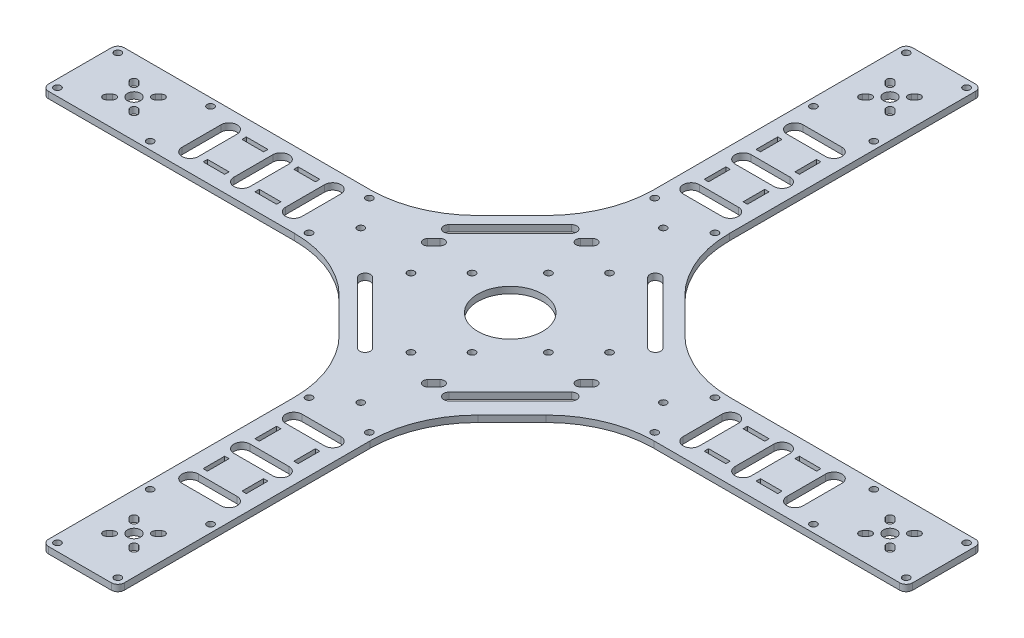
from build123d import *

# Parameters (mm, degrees)
SKETCH_203_R        = 1.6
SKETCH_203_W        = 10
SKETCH_203_H        = 2
SKETCH_203_R_2      = 3
SKETCH_203_W_2      = 2
SKETCH_203_H_2      = 10
EXTRUDE_1_DEPTH     = 3
FILLET_3_R          = 3
SKETCH_1_R          = 1.6
SKETCH_1_R_2        = 15
CUT_EXTRUDE_1_DEPTH = 10


with BuildPart() as part:
    # Sketch 203 → 凸台-拉伸1 (new body)
    with BuildSketch(Plane(origin=(0, 0, 0), x_dir=(1, 0, 0), z_dir=(0, 1, 0))):
        with BuildLine():
            Line((17.5, 25), (-17.5, 25))
            Line((-17.5, 25), (-17.5, -91.789321881))
            ThreePointArc((-17.5, -91.789321881), (-21.306023374, -110.9234935), (-32.144660941, -127.144660941))
            Line((-32.144660941, -127.144660941), (-47.855339059, -142.855339059))
            ThreePointArc((-47.855339059, -142.855339059), (-64.0765065, -153.693976626), (-83.210678119, -157.5))
            Line((-83.210678119, -157.5), (-200, -157.5))
            Line((-200, -157.5), (-200, -192.5))
            Line((-200, -192.5), (-83.210678119, -192.5))
            ThreePointArc((-83.210678119, -192.5), (-64.0765065, -196.306023374), (-47.855339059, -207.144660941))
            Line((-47.855339059, -207.144660941), (-32.144660941, -222.855339059))
            ThreePointArc((-32.144660941, -222.855339059), (-21.306023374, -239.0765065), (-17.5, -258.210678119))
            Line((-17.5, -258.210678119), (-17.5, -375))
            Line((-17.5, -375), (17.5, -375))
            Line((17.5, -375), (17.5, -258.210678119))
            ThreePointArc((17.5, -258.210678119), (21.306023374, -239.0765065), (32.144660941, -222.855339059))
            Line((32.144660941, -222.855339059), (47.855339059, -207.144660941))
            ThreePointArc((47.855339059, -207.144660941), (64.0765065, -196.306023374), (83.210678119, -192.5))
            Line((83.210678119, -192.5), (200, -192.5))
            Line((200, -192.5), (200, -157.5))
            Line((200, -157.5), (83.210678119, -157.5))
            ThreePointArc((83.210678119, -157.5), (64.0765065, -153.693976626), (47.855339059, -142.855339059))
            Line((47.855339059, -142.855339059), (32.144660941, -127.144660941))
            ThreePointArc((32.144660941, -127.144660941), (21.306023374, -110.9234935), (17.5, -91.789321881))
            Line((17.5, -91.789321881), (17.5, 25))
        make_face()
        with Locations(Location((-196.464466094, -188.964466094, 0), (0, 0, 270))):
            Circle(SKETCH_203_R, mode=Mode.SUBTRACT)
        with BuildLine():
            ThreePointArc((-181.081118318, -178.818376618), (-178.818376618, -178.818376618), (-178.818376618, -181.081118318))
            Line((-178.818376618, -181.081118318), (-180.232590181, -182.495331881))
            ThreePointArc((-180.232590181, -182.495331881), (-182.495331881, -182.495331881), (-182.495331881, -180.232590181))
            Line((-182.495331881, -180.232590181), (-181.081118318, -178.818376618))
        make_face(mode=Mode.SUBTRACT)
        with Locations(Location((-153.535533906, -188.964466094, 0), (0, 0, 270))):
            Circle(SKETCH_203_R, mode=Mode.SUBTRACT)
        with BuildLine():
            ThreePointArc((-171.181623382, -181.081118318), (-171.181623382, -178.818376618), (-168.918881682, -178.818376618))
            Line((-168.918881682, -178.818376618), (-167.504668119, -180.232590181))
            ThreePointArc((-167.504668119, -180.232590181), (-167.504668119, -182.495331881), (-169.767409819, -182.495331881))
            Line((-169.767409819, -182.495331881), (-171.181623382, -181.081118318))
        make_face(mode=Mode.SUBTRACT)
        with Locations((-128, -184)):
            Rectangle(SKETCH_203_W, SKETCH_203_H, mode=Mode.SUBTRACT)
        with Locations((-104, -184)):
            Rectangle(SKETCH_203_W, SKETCH_203_H, mode=Mode.SUBTRACT)
        with Locations(Location((-80, -188.964466094, 0), (0, 0, 270))):
            Circle(SKETCH_203_R, mode=Mode.SUBTRACT)
        with Locations(Location((-175, -175, 0), (0, 0, 270))):
            Circle(SKETCH_203_R_2, mode=Mode.SUBTRACT)
        with BuildLine():
            ThreePointArc((-178.818376618, -168.918881682), (-178.818376618, -171.181623382), (-181.081118318, -171.181623382))
            Line((-181.081118318, -171.181623382), (-182.495331881, -169.767409819))
            ThreePointArc((-182.495331881, -169.767409819), (-182.495331881, -167.504668119), (-180.232590181, -167.504668119))
            Line((-180.232590181, -167.504668119), (-178.818376618, -168.918881682))
        make_face(mode=Mode.SUBTRACT)
        with BuildLine():
            ThreePointArc((-168.918881682, -171.181623382), (-171.181623382, -171.181623382), (-171.181623382, -168.918881682))
            Line((-171.181623382, -168.918881682), (-169.767409819, -167.504668119))
            ThreePointArc((-169.767409819, -167.504668119), (-167.504668119, -167.504668119), (-167.504668119, -169.767409819))
            Line((-167.504668119, -169.767409819), (-168.918881682, -171.181623382))
        make_face(mode=Mode.SUBTRACT)
        with Locations(Location((-196.464466094, -161.035533906, 0), (0, 0, 270))):
            Circle(SKETCH_203_R, mode=Mode.SUBTRACT)
        with Locations(Location((-153.535533906, -161.035533906, 0), (0, 0, 270))):
            Circle(SKETCH_203_R, mode=Mode.SUBTRACT)
        with BuildLine():
            ThreePointArc((-143.75, -166), (-140, -162.25), (-136.25, -166))
            Line((-136.25, -166), (-136.25, -184))
            ThreePointArc((-136.25, -184), (-140, -187.75), (-143.75, -184))
            Line((-143.75, -184), (-143.75, -175))
            Line((-143.75, -175), (-143.75, -166))
        make_face(mode=Mode.SUBTRACT)
        Polygon((-133, -167), (-133, -166), (-133, -165), (-123, -165), (-123, -166), (-123, -167), align=None, mode=Mode.SUBTRACT)
        with BuildLine():
            Line((-119.75, -184), (-119.75, -166))
            ThreePointArc((-119.75, -166), (-116, -162.25), (-112.25, -166))
            Line((-112.25, -166), (-112.25, -184))
            ThreePointArc((-112.25, -184), (-116, -187.75), (-119.75, -184))
        make_face(mode=Mode.SUBTRACT)
        with Locations((-104, -166)):
            Rectangle(SKETCH_203_W, SKETCH_203_H, mode=Mode.SUBTRACT)
        with BuildLine():
            ThreePointArc((-88.25, -184), (-92, -187.75), (-95.75, -184))
            Line((-95.75, -184), (-95.75, -166))
            ThreePointArc((-95.75, -166), (-92, -162.25), (-88.25, -166))
            Line((-88.25, -166), (-88.25, -184))
        make_face(mode=Mode.SUBTRACT)
        with Locations(Location((-70, -175, 0), (0, 0, 270))):
            Circle(SKETCH_203_R, mode=Mode.SUBTRACT)
        with Locations(Location((-80, -161.035533906, 0), (0, 0, 270))):
            Circle(SKETCH_203_R, mode=Mode.SUBTRACT)
        with Locations(Location((0, -245, 0), (0, 0, 270))):
            Circle(SKETCH_203_R, mode=Mode.SUBTRACT)
        with Locations(Location((80, -188.964466094, 0), (0, 0, 270))):
            Circle(SKETCH_203_R, mode=Mode.SUBTRACT)
        with Locations((104, -184)):
            Rectangle(SKETCH_203_W, SKETCH_203_H, mode=Mode.SUBTRACT)
        Polygon((123, -183), (133, -183), (133, -184), (133, -185), (123, -185), (123, -184), align=None, mode=Mode.SUBTRACT)
        with Locations(Location((153.535533906, -188.964466094, 0), (0, 0, 270))):
            Circle(SKETCH_203_R, mode=Mode.SUBTRACT)
        with BuildLine():
            ThreePointArc((168.918881682, -178.818376618), (171.181623382, -178.818376618), (171.181623382, -181.081118318))
            Line((171.181623382, -181.081118318), (169.767409819, -182.495331881))
            ThreePointArc((169.767409819, -182.495331881), (167.504668119, -182.495331881), (167.504668119, -180.232590181))
            Line((167.504668119, -180.232590181), (168.918881682, -178.818376618))
        make_face(mode=Mode.SUBTRACT)
        with Locations(Location((196.464466094, -188.964466094, 0), (0, 0, 270))):
            Circle(SKETCH_203_R, mode=Mode.SUBTRACT)
        with BuildLine():
            ThreePointArc((178.818376618, -181.081118318), (178.818376618, -178.818376618), (181.081118318, -178.818376618))
            Line((181.081118318, -178.818376618), (182.495331881, -180.232590181))
            ThreePointArc((182.495331881, -180.232590181), (182.495331881, -182.495331881), (180.232590181, -182.495331881))
            Line((180.232590181, -182.495331881), (178.818376618, -181.081118318))
        make_face(mode=Mode.SUBTRACT)
        with Locations(Location((70, -175, 0), (0, 0, 270))):
            Circle(SKETCH_203_R, mode=Mode.SUBTRACT)
        with BuildLine():
            ThreePointArc((88.25, -166), (92, -162.25), (95.75, -166))
            Line((95.75, -166), (95.75, -184))
            ThreePointArc((95.75, -184), (92, -187.75), (88.25, -184))
            Line((88.25, -184), (88.25, -166))
        make_face(mode=Mode.SUBTRACT)
        with Locations(Location((80, -161.035533906, 0), (0, 0, 270))):
            Circle(SKETCH_203_R, mode=Mode.SUBTRACT)
        with BuildLine():
            Line((119.75, -166), (119.75, -184))
            ThreePointArc((119.75, -184), (116, -187.75), (112.25, -184))
            Line((112.25, -184), (112.25, -166))
            ThreePointArc((112.25, -166), (116, -162.25), (119.75, -166))
        make_face(mode=Mode.SUBTRACT)
        with Locations((104, -166)):
            Rectangle(SKETCH_203_W, SKETCH_203_H, mode=Mode.SUBTRACT)
        with BuildLine():
            ThreePointArc((143.75, -184), (140, -187.75), (136.25, -184))
            Line((136.25, -184), (136.25, -166))
            ThreePointArc((136.25, -166), (140, -162.25), (143.75, -166))
            Line((143.75, -166), (143.75, -175))
            Line((143.75, -175), (143.75, -184))
        make_face(mode=Mode.SUBTRACT)
        with Locations((128, -166)):
            Rectangle(SKETCH_203_W, SKETCH_203_H, mode=Mode.SUBTRACT)
        with BuildLine():
            ThreePointArc((171.181623382, -168.918881682), (171.181623382, -171.181623382), (168.918881682, -171.181623382))
            Line((168.918881682, -171.181623382), (167.504668119, -169.767409819))
            ThreePointArc((167.504668119, -169.767409819), (167.504668119, -167.504668119), (169.767409819, -167.504668119))
            Line((169.767409819, -167.504668119), (171.181623382, -168.918881682))
        make_face(mode=Mode.SUBTRACT)
        with Locations(Location((175, -175, 0), (0, 0, 270))):
            Circle(SKETCH_203_R_2, mode=Mode.SUBTRACT)
        with BuildLine():
            ThreePointArc((181.081118318, -171.181623382), (178.818376618, -171.181623382), (178.818376618, -168.918881682))
            Line((178.818376618, -168.918881682), (180.232590181, -167.504668119))
            ThreePointArc((180.232590181, -167.504668119), (182.495331881, -167.504668119), (182.495331881, -169.767409819))
            Line((182.495331881, -169.767409819), (181.081118318, -171.181623382))
        make_face(mode=Mode.SUBTRACT)
        with Locations(Location((153.535533906, -161.035533906, 0), (0, 0, 270))):
            Circle(SKETCH_203_R, mode=Mode.SUBTRACT)
        with Locations(Location((196.464466094, -161.035533906, 0), (0, 0, 270))):
            Circle(SKETCH_203_R, mode=Mode.SUBTRACT)
        with Locations(Location((0, -105, 0), (0, 0, 270))):
            Circle(SKETCH_203_R, mode=Mode.SUBTRACT)
        with Locations(Location((-13.964466094, -95, 0), (0, 0, 270))):
            Circle(SKETCH_203_R, mode=Mode.SUBTRACT)
        with BuildLine():
            ThreePointArc((-9, -86.75), (-12.75, -83), (-9, -79.25))
            Line((-9, -79.25), (9, -79.25))
            ThreePointArc((9, -79.25), (12.75, -83), (9, -86.75))
            Line((9, -86.75), (-9, -86.75))
        make_face(mode=Mode.SUBTRACT)
        with Locations((-9, -71)):
            Rectangle(SKETCH_203_W_2, SKETCH_203_H_2, mode=Mode.SUBTRACT)
        with BuildLine():
            ThreePointArc((-9, -62.75), (-12.75, -59), (-9, -55.25))
            Line((-9, -55.25), (9, -55.25))
            ThreePointArc((9, -55.25), (12.75, -59), (9, -62.75))
            Line((9, -62.75), (-9, -62.75))
        make_face(mode=Mode.SUBTRACT)
        with Locations((-9, -47)):
            Rectangle(SKETCH_203_W_2, SKETCH_203_H_2, mode=Mode.SUBTRACT)
        with BuildLine():
            ThreePointArc((9, -31.25), (12.75, -35), (9, -38.75))
            Line((9, -38.75), (-9, -38.75))
            ThreePointArc((-9, -38.75), (-12.75, -35), (-9, -31.25))
            Line((-9, -31.25), (0, -31.25))
            Line((0, -31.25), (9, -31.25))
        make_face(mode=Mode.SUBTRACT)
        with Locations(Location((-13.964466094, -21.464466094, 0), (0, 0, 270))):
            Circle(SKETCH_203_R, mode=Mode.SUBTRACT)
        with BuildLine():
            ThreePointArc((-6.081118318, -3.818376618), (-3.818376618, -3.818376618), (-3.818376618, -6.081118318))
            Line((-3.818376618, -6.081118318), (-5.232590181, -7.495331881))
            ThreePointArc((-5.232590181, -7.495331881), (-7.495331881, -7.495331881), (-7.495331881, -5.232590181))
            Line((-7.495331881, -5.232590181), (-6.081118318, -3.818376618))
        make_face(mode=Mode.SUBTRACT)
        with Locations(Location((0, 0, 0), (0, 0, 270))):
            Circle(SKETCH_203_R_2, mode=Mode.SUBTRACT)
        with BuildLine():
            ThreePointArc((-3.818376618, 6.081118318), (-3.818376618, 3.818376618), (-6.081118318, 3.818376618))
            Line((-6.081118318, 3.818376618), (-7.495331881, 5.232590181))
            ThreePointArc((-7.495331881, 5.232590181), (-7.495331881, 7.495331881), (-5.232590181, 7.495331881))
            Line((-5.232590181, 7.495331881), (-3.818376618, 6.081118318))
        make_face(mode=Mode.SUBTRACT)
        with Locations(Location((-13.964466094, 21.464466094, 0), (0, 0, 270))):
            Circle(SKETCH_203_R, mode=Mode.SUBTRACT)
        with Locations(Location((13.964466094, -95, 0), (0, 0, 270))):
            Circle(SKETCH_203_R, mode=Mode.SUBTRACT)
        with Locations((9, -71)):
            Rectangle(SKETCH_203_W_2, SKETCH_203_H_2, mode=Mode.SUBTRACT)
        Polygon((10, -52), (9, -52), (8, -52), (8, -42), (9, -42), (10, -42), align=None, mode=Mode.SUBTRACT)
        with Locations(Location((13.964466094, -21.464466094, 0), (0, 0, 270))):
            Circle(SKETCH_203_R, mode=Mode.SUBTRACT)
        with BuildLine():
            ThreePointArc((3.818376618, -6.081118318), (3.818376618, -3.818376618), (6.081118318, -3.818376618))
            Line((6.081118318, -3.818376618), (7.495331881, -5.232590181))
            ThreePointArc((7.495331881, -5.232590181), (7.495331881, -7.495331881), (5.232590181, -7.495331881))
            Line((5.232590181, -7.495331881), (3.818376618, -6.081118318))
        make_face(mode=Mode.SUBTRACT)
        with BuildLine():
            ThreePointArc((6.081118318, 3.818376618), (3.818376618, 3.818376618), (3.818376618, 6.081118318))
            Line((3.818376618, 6.081118318), (5.232590181, 7.495331881))
            ThreePointArc((5.232590181, 7.495331881), (7.495331881, 7.495331881), (7.495331881, 5.232590181))
            Line((7.495331881, 5.232590181), (6.081118318, 3.818376618))
        make_face(mode=Mode.SUBTRACT)
        with Locations(Location((13.964466094, 21.464466094, 0), (0, 0, 270))):
            Circle(SKETCH_203_R, mode=Mode.SUBTRACT)
        with Locations(Location((-13.964466094, -371.464466094, 0), (0, 0, 270))):
            Circle(SKETCH_203_R, mode=Mode.SUBTRACT)
        with BuildLine():
            ThreePointArc((-6.081118318, -353.818376618), (-3.818376618, -353.818376618), (-3.818376618, -356.081118318))
            Line((-3.818376618, -356.081118318), (-5.232590181, -357.495331881))
            ThreePointArc((-5.232590181, -357.495331881), (-7.495331881, -357.495331881), (-7.495331881, -355.232590181))
            Line((-7.495331881, -355.232590181), (-6.081118318, -353.818376618))
        make_face(mode=Mode.SUBTRACT)
        with BuildLine():
            ThreePointArc((-3.818376618, -343.918881682), (-3.818376618, -346.181623382), (-6.081118318, -346.181623382))
            Line((-6.081118318, -346.181623382), (-7.495331881, -344.767409819))
            ThreePointArc((-7.495331881, -344.767409819), (-7.495331881, -342.504668119), (-5.232590181, -342.504668119))
            Line((-5.232590181, -342.504668119), (-3.818376618, -343.918881682))
        make_face(mode=Mode.SUBTRACT)
        with Locations(Location((0, -350, 0), (0, 0, 270))):
            Circle(SKETCH_203_R_2, mode=Mode.SUBTRACT)
        with Locations(Location((-13.964466094, -328.535533906, 0), (0, 0, 270))):
            Circle(SKETCH_203_R, mode=Mode.SUBTRACT)
        with BuildLine():
            ThreePointArc((3.818376618, -356.081118318), (3.818376618, -353.818376618), (6.081118318, -353.818376618))
            Line((6.081118318, -353.818376618), (7.495331881, -355.232590181))
            ThreePointArc((7.495331881, -355.232590181), (7.495331881, -357.495331881), (5.232590181, -357.495331881))
            Line((5.232590181, -357.495331881), (3.818376618, -356.081118318))
        make_face(mode=Mode.SUBTRACT)
        with BuildLine():
            ThreePointArc((6.081118318, -346.181623382), (3.818376618, -346.181623382), (3.818376618, -343.918881682))
            Line((3.818376618, -343.918881682), (5.232590181, -342.504668119))
            ThreePointArc((5.232590181, -342.504668119), (7.495331881, -342.504668119), (7.495331881, -344.767409819))
            Line((7.495331881, -344.767409819), (6.081118318, -346.181623382))
        make_face(mode=Mode.SUBTRACT)
        with Locations(Location((13.964466094, -371.464466094, 0), (0, 0, 270))):
            Circle(SKETCH_203_R, mode=Mode.SUBTRACT)
        with BuildLine():
            ThreePointArc((-9, -318.75), (-12.75, -315), (-9, -311.25))
            Line((-9, -311.25), (9, -311.25))
            ThreePointArc((9, -311.25), (12.75, -315), (9, -318.75))
            Line((9, -318.75), (0, -318.75))
            Line((0, -318.75), (-9, -318.75))
        make_face(mode=Mode.SUBTRACT)
        with Locations(Location((13.964466094, -328.535533906, 0), (0, 0, 270))):
            Circle(SKETCH_203_R, mode=Mode.SUBTRACT)
        Polygon((-8, -308), (-9, -308), (-10, -308), (-10, -298), (-9, -298), (-8, -298), align=None, mode=Mode.SUBTRACT)
        with Locations((-9, -279)):
            Rectangle(SKETCH_203_W_2, SKETCH_203_H_2, mode=Mode.SUBTRACT)
        with Locations(Location((-13.964466094, -255, 0), (0, 0, 270))):
            Circle(SKETCH_203_R, mode=Mode.SUBTRACT)
        with BuildLine():
            Line((9, -294.75), (-9, -294.75))
            ThreePointArc((-9, -294.75), (-12.75, -291), (-9, -287.25))
            Line((-9, -287.25), (9, -287.25))
            ThreePointArc((9, -287.25), (12.75, -291), (9, -294.75))
        make_face(mode=Mode.SUBTRACT)
        with Locations((9, -303)):
            Rectangle(SKETCH_203_W_2, SKETCH_203_H_2, mode=Mode.SUBTRACT)
        with BuildLine():
            ThreePointArc((9, -263.25), (12.75, -267), (9, -270.75))
            Line((9, -270.75), (-9, -270.75))
            ThreePointArc((-9, -270.75), (-12.75, -267), (-9, -263.25))
            Line((-9, -263.25), (9, -263.25))
        make_face(mode=Mode.SUBTRACT)
        with Locations((9, -279)):
            Rectangle(SKETCH_203_W_2, SKETCH_203_H_2, mode=Mode.SUBTRACT)
        with Locations(Location((13.964466094, -255, 0), (0, 0, 270))):
            Circle(SKETCH_203_R, mode=Mode.SUBTRACT)
    extrude(amount=EXTRUDE_1_DEPTH)

    # 圆角3
    fillet_3_edges = [part.edges().sort_by_distance(p)[0] for p in [
        (-200, 1.5, 192.5),
        (-200, 1.5, 157.5),
        (-17.5, 1.5, -25),
        (17.5, 1.5, -25),
        (200, 1.5, 157.5),
        (200, 1.5, 192.5),
        (17.5, 1.5, 375),
        (-17.5, 1.5, 375),
    ]]
    fillet(fillet_3_edges, radius=FILLET_3_R)

    # 草图1 → 切除-拉伸1 (cut)
    with BuildSketch(Plane(origin=(0, 3, 0), x_dir=(1, 0, 0), z_dir=(0, 1, 0))):
        with BuildLine():
            Line((-19.105977037, -220.360548142), (-33.248112661, -206.218412519))
            Line((-33.248112661, -206.218412519), (-47.390248285, -192.076276895))
            ThreePointArc((-47.390248285, -192.076276895), (-50.92578219, -192.076276895), (-50.92578219, -195.611810801))
            Line((-50.92578219, -195.611810801), (-22.641510943, -223.896082048))
            ThreePointArc((-22.641510943, -223.896082048), (-19.105977037, -223.896082048), (-19.105977037, -220.360548142))
        make_face()
        with Locations(Location((-40.319180473, -181.469675177, 0), (0, 0, 270))):
            Circle(SKETCH_1_R)
        with BuildLine():
            Line((44.53363327, -192.076276895), (16.249362022, -220.360548142))
            ThreePointArc((16.249362022, -220.360548142), (16.249362022, -223.896082048), (19.784895928, -223.896082048))
            Line((19.784895928, -223.896082048), (48.069167176, -195.611810801))
            ThreePointArc((48.069167176, -195.611810801), (48.069167176, -192.076276895), (44.53363327, -192.076276895))
        make_face()
        with BuildLine():
            ThreePointArc((12.077432013, -220.431258821), (12.692507773, -218.94633458), (12.077432013, -217.46141034))
            ThreePointArc((12.077432013, -217.46141034), (10.592507773, -216.84633458), (9.107583532, -217.46141034))
            Line((9.107583532, -217.46141034), (6.279156407, -220.289837464))
            ThreePointArc((6.279156407, -220.289837464), (6.279156407, -223.259685945), (9.249004888, -223.259685945))
            Line((9.249004888, -223.259685945), (12.077432013, -220.431258821))
        make_face()
        with BuildLine():
            ThreePointArc((41.634495467, -184.934498405), (41.019419707, -186.419422645), (41.634495467, -187.904346886))
            ThreePointArc((41.634495467, -187.904346886), (43.119419707, -188.519422645), (44.604343948, -187.904346886))
            Line((44.604343948, -187.904346886), (47.432771073, -185.075919761))
            ThreePointArc((47.432771073, -185.075919761), (47.432771073, -182.10607128), (44.462922592, -182.10607128))
            Line((44.462922592, -182.10607128), (41.634495467, -184.934498405))
        make_face()
        with BuildLine():
            ThreePointArc((-50.289386087, -163.721294969), (-50.289386087, -166.69114345), (-47.319537606, -166.69114345))
            Line((-47.319537606, -166.69114345), (-44.491110482, -163.862716326))
            ThreePointArc((-44.491110482, -163.862716326), (-44.491110482, -160.892867845), (-47.460958963, -160.892867845))
            Line((-47.460958963, -160.892867845), (-50.289386087, -163.721294969))
        make_face()
        with BuildLine():
            ThreePointArc((-9.135771422, -128.507377266), (-9.135771422, -125.537528785), (-12.105619903, -125.537528785))
            Line((-12.105619903, -125.537528785), (-14.934047028, -128.36595591))
            ThreePointArc((-14.934047028, -128.36595591), (-14.934047028, -131.335804391), (-11.964198547, -131.335804391))
            Line((-11.964198547, -131.335804391), (-9.135771422, -128.507377266))
        make_face()
        with BuildLine():
            Line((-47.390248285, -156.720937836), (-19.105977037, -128.436666588))
            ThreePointArc((-19.105977037, -128.436666588), (-19.105977037, -124.901132682), (-22.641510943, -124.901132682))
            Line((-22.641510943, -124.901132682), (-50.92578219, -153.18540393))
            ThreePointArc((-50.92578219, -153.18540393), (-50.92578219, -156.720937836), (-47.390248285, -156.720937836))
        make_face()
        with BuildLine():
            Line((16.249362022, -128.436666588), (44.53363327, -156.720937836))
            ThreePointArc((44.53363327, -156.720937836), (48.069167176, -156.720937836), (48.069167176, -153.18540393))
            Line((48.069167176, -153.18540393), (19.784895928, -124.901132682))
            ThreePointArc((19.784895928, -124.901132682), (16.249362022, -124.901132682), (16.249362022, -128.436666588))
        make_face()
        with Locations(Location((-8.499375319, -213.289480331, 0), (0, 0, 270))):
            Circle(SKETCH_1_R)
        with Locations(Location((-8.499375319, -149.649870024, 0), (0, 0, 270))):
            Circle(SKETCH_1_R)
        with Locations(Location((23.320429834, -181.469675177, 0), (0, 0, 270))):
            Circle(SKETCH_1_R)
        with Locations(Location((37.462565458, -167.327539553, 0), (0, 0, 270))):
            Circle(SKETCH_1_R)
        with Locations(Location((5.642760304, -135.5077344, 0), (0, 0, 270))):
            Circle(SKETCH_1_R)
        with Locations(Location((-26.177044849, -167.327539553, 0), (0, 0, 270))):
            Circle(SKETCH_1_R)
        with Locations(Location((5.642760304, -199.147344707, 0), (0, 0, 270))):
            Circle(SKETCH_1_R)
        with Locations(Location((-1.428307507, -174.398607365, 0), (0, 0, 270))):
            Circle(SKETCH_1_R_2)
    extrude(amount=-CUT_EXTRUDE_1_DEPTH, mode=Mode.SUBTRACT)


solid = part.part
